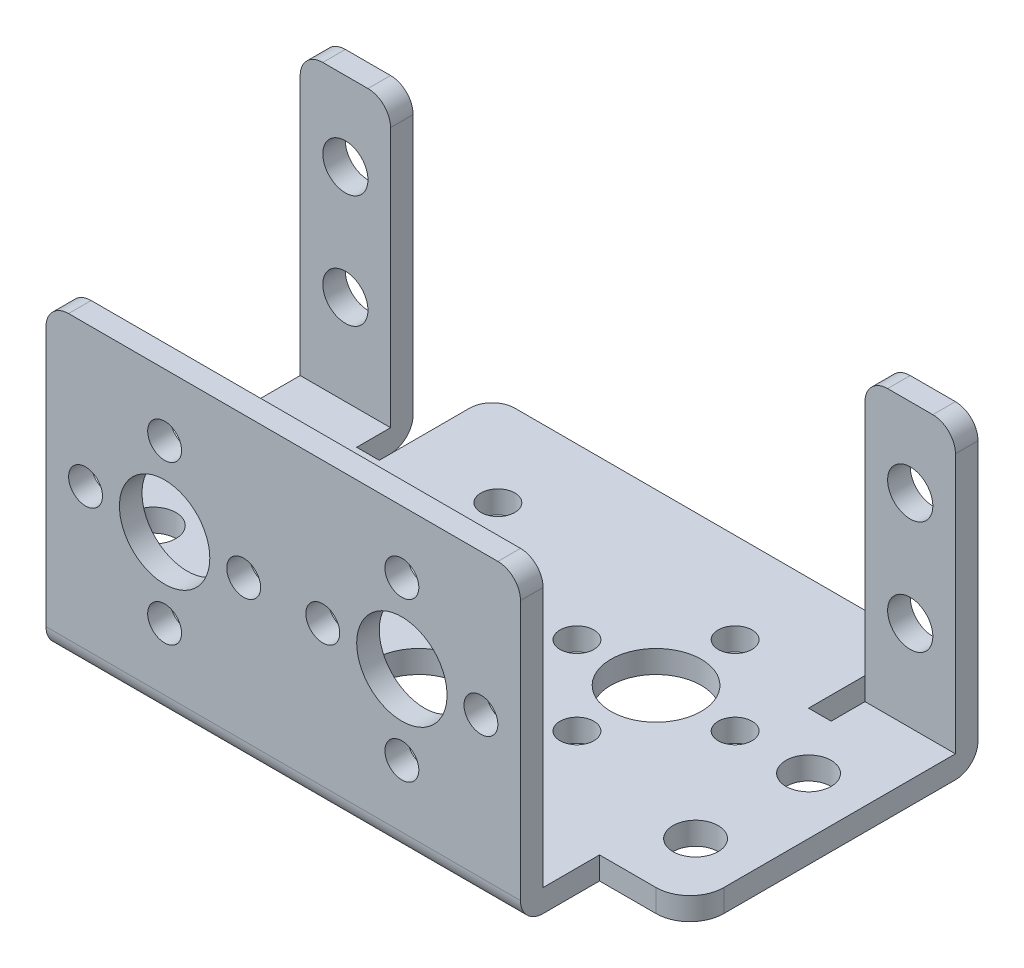
from build123d import *

# Parameters (mm, degrees)
SKETCH_1_R          = 4
SKETCH_1_R_2        = 1.383428465
SKETCH_1_R_3        = 1.5
SKETCH_1_R_4        = 2
EXTRUDE_1_DEPTH     = 2
SKETCH_2_W          = 8
SKETCH_2_H          = 2
SKETCH_2_W_2        = 42
EXTRUDE_2_DEPTH     = 25
FILLET_1_R          = 2
SKETCH_3_R          = 4
SKETCH_3_R_2        = 1.5
CUT_EXTRUDE_2_DEPTH = 2
FILLET_2_R          = 2
SKETCH_4_R          = 2
CUT_EXTRUDE_3_DEPTH = 90


with BuildPart() as part:
    # 草图1 → 凸台-拉伸1 (new body)
    with BuildSketch(Plane(origin=(0, 0, 0), x_dir=(1, 0, 0), z_dir=(0, 1, 0))):
        with BuildLine():
            Line((-17, 17.25), (17, 17.25))
            ThreePointArc((17, 17.25), (18.414213562, 16.664213562), (19, 15.25))
            Line((19, 15.25), (19, 7.25))
            Line((19, 7.25), (21, 7.25))
            Line((21, 7.25), (21, 12.25))
            Line((21, 12.25), (29, 12.25))
            Line((29, 12.25), (29, -10.25))
            ThreePointArc((29, -10.25), (28.121320344, -12.371320344), (26, -13.25))
            Line((26, -13.25), (21, -13.25))
            Line((21, -13.25), (21, -20.25))
            Line((21, -20.25), (-21, -20.25))
            Line((-21, -20.25), (-21, -13.25))
            Line((-21, -13.25), (-26, -13.25))
            ThreePointArc((-26, -13.25), (-28.121320344, -12.371320344), (-29, -10.25))
            Line((-29, -10.25), (-29, 12.25))
            Line((-29, 12.25), (-21, 12.25))
            Line((-21, 12.25), (-21, 7.25))
            Line((-21, 7.25), (-19, 7.25))
            Line((-19, 7.25), (-19, 15.25))
            ThreePointArc((-19, 15.25), (-18.414213562, 16.664213562), (-17, 17.25))
        make_face()
        with Locations(Location((0, -8.25, 0), (0, 0, 270))):
            Circle(SKETCH_1_R, mode=Mode.SUBTRACT)
        with Locations(Location((0, -1.25, 0), (0, 0, 270))):
            Circle(SKETCH_1_R_2, mode=Mode.SUBTRACT)
        with Locations(Location((-7, -8.25, 0), (0, 0, 270))):
            Circle(SKETCH_1_R_3, mode=Mode.SUBTRACT)
        with Locations(Location((0, -15.25, 0), (0, 0, 270))):
            Circle(SKETCH_1_R_3, mode=Mode.SUBTRACT)
        with Locations(Location((7, -8.25, 0), (0, 0, 270))):
            Circle(SKETCH_1_R_3, mode=Mode.SUBTRACT)
        with Locations(Location((-10.5, 2.25, 0), (0, 0, 270))):
            Circle(SKETCH_1_R, mode=Mode.SUBTRACT)
        with Locations(Location((-10.5, 9.25, 0), (0, 0, 270))):
            Circle(SKETCH_1_R_3, mode=Mode.SUBTRACT)
        with Locations(Location((-3.5, 2.25, 0), (0, 0, 270))):
            Circle(SKETCH_1_R_3, mode=Mode.SUBTRACT)
        with Locations(Location((-17.5, 2.25, 0), (0, 0, 270))):
            Circle(SKETCH_1_R_3, mode=Mode.SUBTRACT)
        with Locations(Location((-10.5, -4.75, 0), (0, 0, 270))):
            Circle(SKETCH_1_R_3, mode=Mode.SUBTRACT)
        with Locations(Location((10.5, -4.75, 0), (0, 0, 90))):
            Circle(SKETCH_1_R_3, mode=Mode.SUBTRACT)
        with Locations(Location((3.5, 2.25, 0), (0, 0, 90))):
            Circle(SKETCH_1_R_3, mode=Mode.SUBTRACT)
        with Locations(Location((17.5, 2.25, 0), (0, 0, 90))):
            Circle(SKETCH_1_R_3, mode=Mode.SUBTRACT)
        with Locations(Location((10.5, 9.25, 0), (0, 0, 90))):
            Circle(SKETCH_1_R_3, mode=Mode.SUBTRACT)
        with Locations(Location((10.5, 2.25, 0), (0, 0, 90))):
            Circle(SKETCH_1_R, mode=Mode.SUBTRACT)
        with Locations(Location((-24, 2.25, 0), (0, 0, 270))):
            Circle(SKETCH_1_R_4, mode=Mode.SUBTRACT)
        with Locations(Location((24, 2.25, 0), (0, 0, 270))):
            Circle(SKETCH_1_R_4, mode=Mode.SUBTRACT)
        with Locations(Location((-24, -7.75, 0), (0, 0, 270))):
            Circle(SKETCH_1_R_4, mode=Mode.SUBTRACT)
        with Locations(Location((24, -7.75, 0), (0, 0, 270))):
            Circle(SKETCH_1_R_4, mode=Mode.SUBTRACT)
    extrude(amount=EXTRUDE_1_DEPTH)

    # 草图2 → 凸台-拉伸2 (add)
    with BuildSketch(Plane(origin=(0, 2, 0), x_dir=(1, 0, 0), z_dir=(0, 1, 0))):
        with Locations((-25, 11.25)):
            Rectangle(SKETCH_2_W, SKETCH_2_H)
        with Locations((0, -19.25)):
            Rectangle(SKETCH_2_W_2, SKETCH_2_H)
        with Locations((25, 11.25)):
            Rectangle(SKETCH_2_W, SKETCH_2_H)
    extrude(amount=EXTRUDE_2_DEPTH)

    # 圆角1
    fillet_1_edges = [part.edges().sort_by_distance(p)[0] for p in [
        (0, 0, 20.25),
        (-25, 0, -12.25),
        (25, 0, -12.25),
    ]]
    fillet(fillet_1_edges, radius=FILLET_1_R)

    # 草图3 → 切除-拉伸2 (cut)
    with BuildSketch(Plane.XY.offset(20.25)):
        with Locations((-10.5, 14.5)):
            Circle(SKETCH_3_R)
        with Locations((-10.5, 21.5)):
            Circle(SKETCH_3_R_2)
        with Locations((-17.5, 14.5)):
            Circle(SKETCH_3_R_2)
        with Locations((-3.5, 14.5)):
            Circle(SKETCH_3_R_2)
        with Locations((-10.5, 7.5)):
            Circle(SKETCH_3_R_2)
        with Locations(Location((17.5, 14.5, 0), (0, 0, 180))):
            Circle(SKETCH_3_R_2)
        with Locations(Location((10.5, 14.5, 0), (0, 0, 180))):
            Circle(SKETCH_3_R)
        with Locations(Location((3.5, 14.5, 0), (0, 0, 180))):
            Circle(SKETCH_3_R_2)
        with Locations(Location((10.5, 21.5, 0), (0, 0, 180))):
            Circle(SKETCH_3_R_2)
        with Locations(Location((10.5, 7.5, 0), (0, 0, 180))):
            Circle(SKETCH_3_R_2)
        with BuildLine():
            Line((-19, 27), (19, 27))
            ThreePointArc((19, 27), (20.414213562, 26.414213562), (21, 25))
            Line((21, 25), (21, 28.113497729))
            Line((21, 28.113497729), (-21, 28.113497729))
            Line((-21, 28.113497729), (-21, 25))
            ThreePointArc((-21, 25), (-20.414213562, 26.414213562), (-19, 27))
        make_face()
    extrude(amount=-CUT_EXTRUDE_2_DEPTH, mode=Mode.SUBTRACT)

    # 圆角2
    fillet_2_edges = [part.edges().sort_by_distance(p)[0] for p in [
        (-29, 27, -11.25),
        (-21, 27, -11.25),
        (29, 27, -11.25),
        (21, 27, -11.25),
    ]]
    fillet(fillet_2_edges, radius=FILLET_2_R)

    # 草图4 → 切除-拉伸3 (cut)
    with BuildSketch(Plane(origin=(0, 0, -12.25), x_dir=(-1, 0, 0), z_dir=(0, 0, -1))):
        with Locations((-25, 20)):
            Circle(SKETCH_4_R)
        with Locations((-25, 10)):
            Circle(SKETCH_4_R)
        with Locations((25, 20)):
            Circle(SKETCH_4_R)
        with Locations((25, 10)):
            Circle(SKETCH_4_R)
    extrude(amount=-CUT_EXTRUDE_3_DEPTH, mode=Mode.SUBTRACT)


solid = part.part
